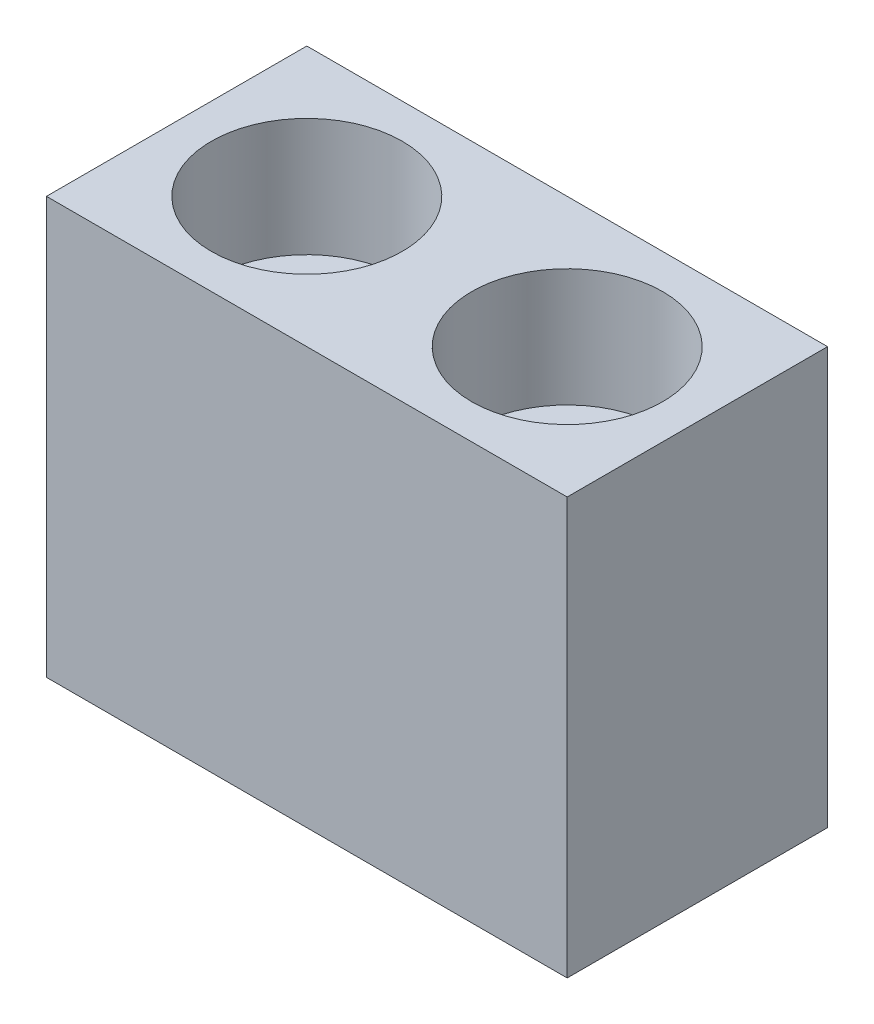
from build123d import *

# Parameters (mm, degrees)
SKETCH_1_W                = 30
SKETCH_1_H                = 15
EXTRUDE_1_DEPTH           = 24
HOLE_WIZARD_1_D           = 6.6
HOLE_WIZARD_1_CBORE_D     = 11
HOLE_WIZARD_1_CBORE_DEPTH = 6.8


with BuildPart() as part:
    # 草图1 → 凸台-拉伸1 (new body)
    with BuildSketch(Plane(origin=(0, 0, 0), x_dir=(1, 0, 0), z_dir=(0, 1, 0))):
        Rectangle(SKETCH_1_W, SKETCH_1_H)
    extrude(amount=EXTRUDE_1_DEPTH)

    # 打孔尺寸根据内六角圆柱头螺钉的类型1 (through all)
    with Locations(Plane(origin=(0, 24, 0), x_dir=(1, 0, 0), z_dir=(0, 1, 0))):
        with Locations((-7.5, 0), (7.5, 0)):
            CounterBoreHole(HOLE_WIZARD_1_D / 2, HOLE_WIZARD_1_CBORE_D / 2, HOLE_WIZARD_1_CBORE_DEPTH)


solid = part.part
